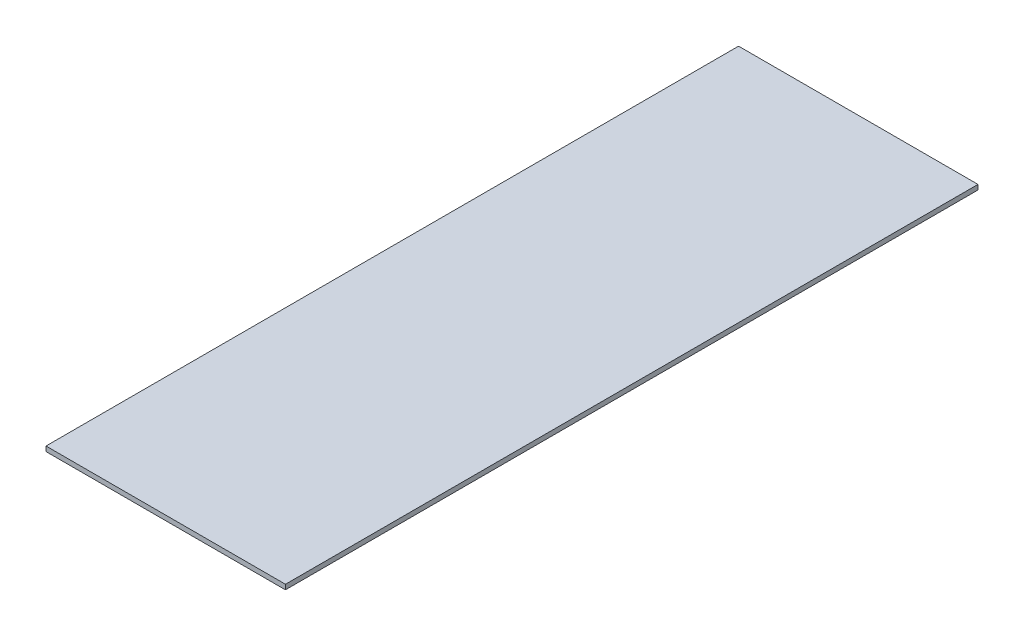
from build123d import *

# Parameters (mm, degrees)
SKETCH1_W           = 156.688508546
SKETCH1_H           = 3.175
BOSS_EXTRUDE1_DEPTH = 453.2


with BuildPart() as part:
    # Sketch1 → Boss-Extrude1 (new body)
    with BuildSketch(Plane.XY):
        with Locations((0, 71.699747591)):
            Rectangle(SKETCH1_W, SKETCH1_H)
    extrude(amount=-BOSS_EXTRUDE1_DEPTH)


solid = part.part
